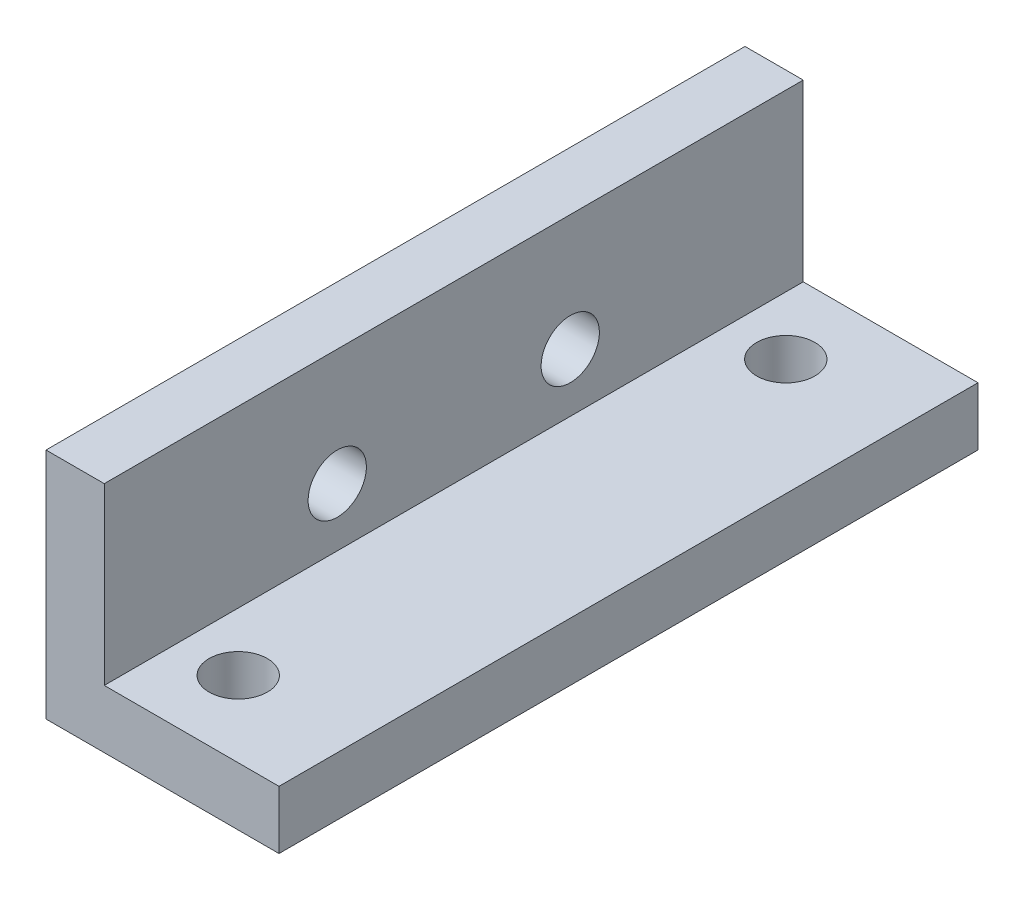
from build123d import *

# Parameters (mm, degrees)
BOSS_EXTRUDE1_DEPTH = 38.1
SKETCH2_R           = 1.5875
CUT_EXTRUDE1_DEPTH  = 43.121134838
SKETCH3_R           = 1.5875
CUT_EXTRUDE2_DEPTH  = 43.121134838


with BuildPart() as part:
    # Sketch1 → Boss-Extrude1 (new body)
    with BuildSketch(Plane.XY):
        Polygon((0, 12.7), (0, 0), (12.7, 0), (12.7, 3.175), (3.175, 3.175), (3.175, 12.7), align=None)
    extrude(amount=BOSS_EXTRUDE1_DEPTH)

    # Sketch2 → Cut-Extrude1 (cut, through all)
    with BuildSketch(Plane.ZY):
        with Locations(Location((12.7, 6.35, 0), (0, 0, 270))):
            Circle(SKETCH2_R)
        with Locations(Location((25.4, 6.35, 0), (0, 0, 270))):
            Circle(SKETCH2_R)
    extrude(amount=-CUT_EXTRUDE1_DEPTH, mode=Mode.SUBTRACT)

    # Sketch3 → Cut-Extrude2 (cut, through all)
    with BuildSketch(Plane.XZ):
        with Locations(Location((6.35, 4.1275, 0), (0, 0, 270))):
            Circle(SKETCH3_R)
        with Locations(Location((6.35, 33.9725, 0), (0, 0, 270))):
            Circle(SKETCH3_R)
    extrude(amount=-CUT_EXTRUDE2_DEPTH, mode=Mode.SUBTRACT)


solid = part.part
